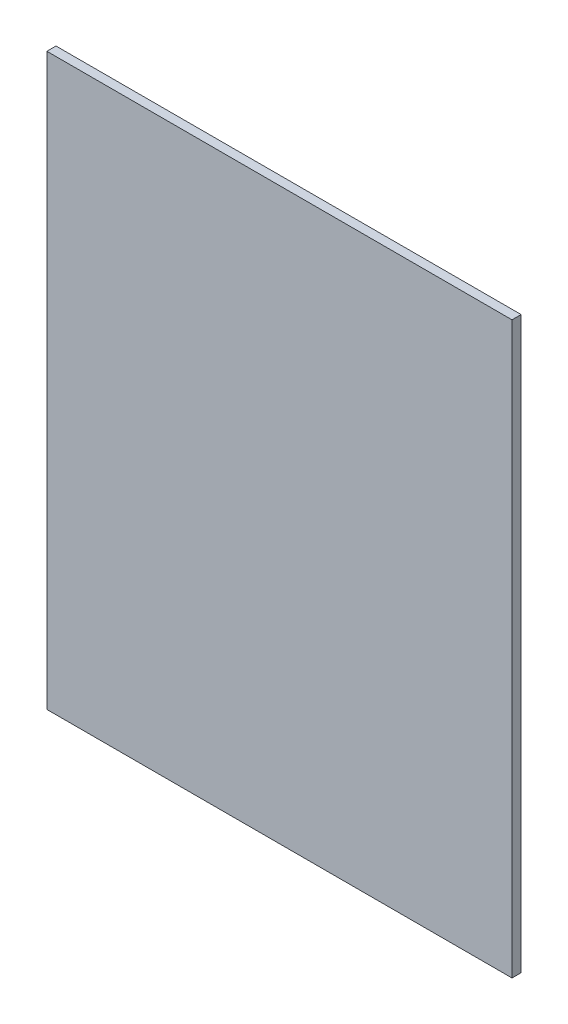
from build123d import *

# Parameters (mm, degrees)
SKETCH1_W           = 204
SKETCH1_H           = 250
BOSS_EXTRUDE1_DEPTH = 4


with BuildPart() as part:
    # Sketch1 → Boss-Extrude1 (new body)
    with BuildSketch(Plane.XY):
        Rectangle(SKETCH1_W, SKETCH1_H)
    extrude(amount=BOSS_EXTRUDE1_DEPTH)


solid = part.part
